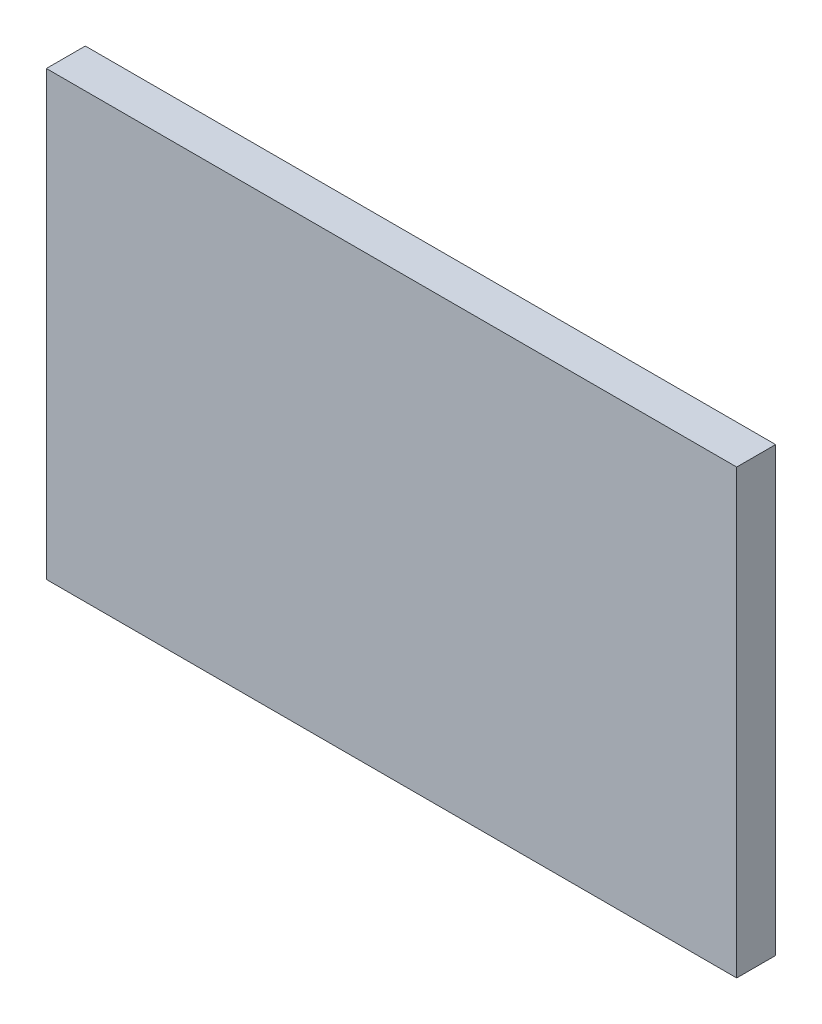
from build123d import *

# Parameters (mm, degrees)
SKETCH1_W           = 99.06
SKETCH1_H           = 63.5
BOSS_EXTRUDE1_DEPTH = 5.588


with BuildPart() as part:
    # Sketch1 → Boss-Extrude1 (new body)
    with BuildSketch(Plane.XY):
        Rectangle(SKETCH1_W, SKETCH1_H)
    extrude(amount=BOSS_EXTRUDE1_DEPTH)


solid = part.part
